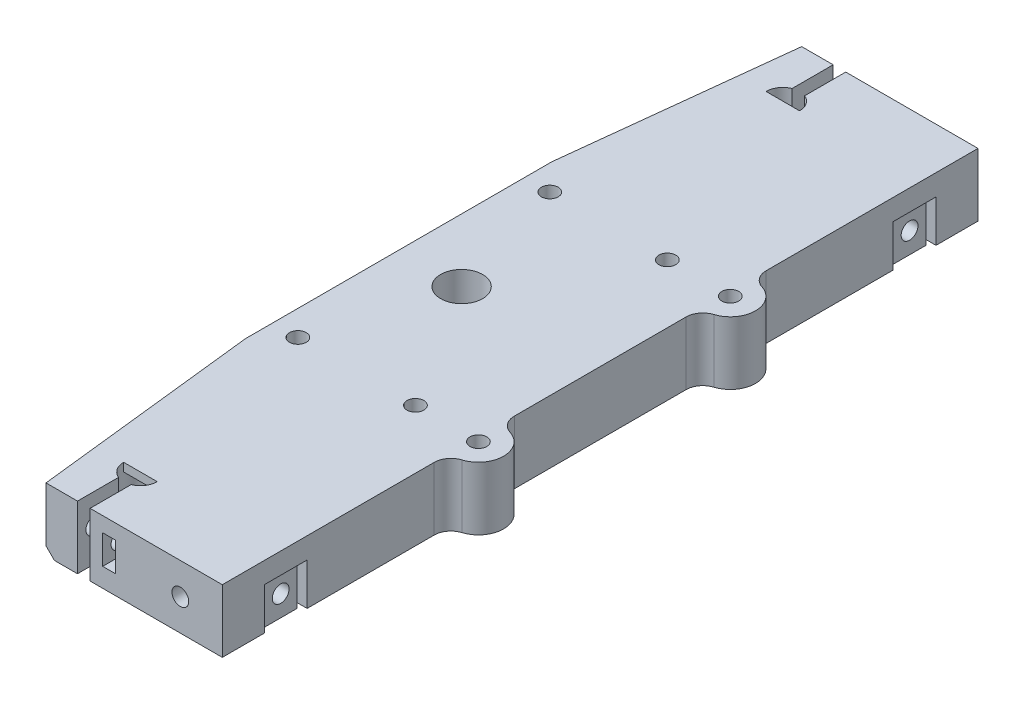
from build123d import *

# Parameters (mm, degrees)
SZKIC1_R                    = 5
SZKIC1_R_2                  = 2
DODANIE_WYCI_GNI_CIE1_DEPTH = 15
DODANIE_WYCI_GNI_CIE3_START = -2
DODANIE_WYCI_GNI_CIE3_DEPTH = 2
DODANIE_WYCI_GNI_CIE4_DEPTH = 15
SZKIC5_R                    = 2
WYTNIJ_WYCI_GNI_CIE1_DEPTH  = 15
ZAOKR_GLENIE1_R             = 4
SFAZOWANIE1_SIZE            = 2
WYTNIJ_WYCI_GNI_CIE3_START  = -7
SZKIC8_R                    = 2
WYTNIJ_WYCI_GNI_CIE3_DEPTH  = 107.031560626
WYTNIJ_WYCI_GNI_CIE4_START  = 8
SZKIC9_R                    = 3.5
WYTNIJ_WYCI_GNI_CIE4_DEPTH  = 4
WYTNIJ_WYCI_GNI_CIE5_START  = -6
SZKIC10_R                   = 2
WYTNIJ_WYCI_GNI_CIE5_DEPTH  = 3
SZKIC11_R                   = 2
WYTNIJ_WYCI_GNI_CIE6_DEPTH  = 7
SZKIC12_W                   = 10.2
SZKIC12_H                   = 10.2
SZKIC12_W_2                 = 7.8
SZKIC12_H_2                 = 7.8
WYTNIJ_WYCI_GNI_CIE7_DEPTH  = 10
SZKIC13_R                   = 2
WYTNIJ_WYCI_GNI_CIE8_DEPTH  = 8


with BuildPart() as part:
    # Szkic1 → Dodanie-wyciągnięcie1 (new body)
    with BuildSketch(Plane(origin=(0, 0, 0), x_dir=(1, 0, 0), z_dir=(0, 1, 0))):
        with BuildLine():
            Line((-14.5, 90), (-20.5, 36.5))
            Line((-20.5, 36.5), (-20.5, -36.5))
            Line((-20.5, -36.5), (-14.5, -90))
            Line((-14.5, -90), (-7, -90))
            Line((-7, -90), (-7, -80.208099244))
            ThreePointArc((-7, -80.208099244), (-5.5, -72.5), (-4, -80.208099244))
            Line((-4, -80.208099244), (-4, -90))
            Line((-4, -90), (27.5, -90))
            Line((27.5, -90), (27.5, 90))
            Line((27.5, 90), (-3.999999674, 90))
            Line((-3.999999674, 90), (-4, 80.208099244))
            ThreePointArc((-4, 80.208099244), (-5.5, 72.5), (-7, 80.208099244))
            Line((-7, 80.208099244), (-6.999999674, 90))
            Line((-6.999999674, 90), (-14.5, 90))
        make_face()
        with Locations((-5.5, 0)):
            Circle(SZKIC1_R, mode=Mode.SUBTRACT)
        with Locations((-14.5, 30)):
            Circle(SZKIC1_R_2, mode=Mode.SUBTRACT)
        with Locations((13.5, 30)):
            Circle(SZKIC1_R_2, mode=Mode.SUBTRACT)
        with Locations((-14.5, -30)):
            Circle(SZKIC1_R_2, mode=Mode.SUBTRACT)
        with Locations((13.5, -30)):
            Circle(SZKIC1_R_2, mode=Mode.SUBTRACT)
    extrude(amount=DODANIE_WYCI_GNI_CIE1_DEPTH)

    # Szkic3 → Dodanie-wyciągnięcie3 (add)
    with BuildSketch(Plane(origin=(0, 15, 0), x_dir=(1, 0, 0), z_dir=(0, 1, 0)).offset(DODANIE_WYCI_GNI_CIE3_START)):
        with BuildLine():
            Line((-1.5, 76.5), (-9.5, 76.5))
            ThreePointArc((-9.5, 76.5), (-5.5, 72.5), (-1.5, 76.5))
        make_face()
        with BuildLine():
            ThreePointArc((-1.5, -76.5), (-5.5, -72.5), (-9.5, -76.5))
            Line((-9.5, -76.5), (-1.5, -76.5))
        make_face()
    extrude(amount=DODANIE_WYCI_GNI_CIE3_DEPTH)

    # Szkic4 → Dodanie-wyciągnięcie4 (add)
    with BuildSketch(Plane(origin=(0, 15, 0), x_dir=(1, 0, 0), z_dir=(0, 1, 0))):
        with BuildLine():
            ThreePointArc((27.5, -28.267949192), (30.5, -30), (27.5, -31.732050808))
            Line((27.5, -31.732050808), (27.5, -35.916079783))
            ThreePointArc((27.5, -35.916079783), (34.5, -30), (27.5, -24.083920217))
            Line((27.5, -24.083920217), (27.5, -28.267949192))
        make_face()
        with BuildLine():
            Line((27.5, 28.267949192), (27.5, 24.083920217))
            ThreePointArc((27.5, 24.083920217), (34.5, 30), (27.5, 35.916079783))
            Line((27.5, 35.916079783), (27.5, 31.732050808))
            ThreePointArc((27.5, 31.732050808), (30.5, 30), (27.5, 28.267949192))
        make_face()
    extrude(amount=-DODANIE_WYCI_GNI_CIE4_DEPTH)

    # Szkic5 → Wytnij-wyciągnięcie1 (cut)
    with BuildSketch(Plane(origin=(0, 15, 0), x_dir=(1, 0, 0), z_dir=(0, 1, 0))):
        with Locations((28.5, 30)):
            Circle(SZKIC5_R)
        with Locations((28.5, -30)):
            Circle(SZKIC5_R)
    extrude(amount=-WYTNIJ_WYCI_GNI_CIE1_DEPTH, mode=Mode.SUBTRACT)

    # Zaokrąglenie1
    zaokr_glenie1_edges = [part.edges().sort_by_distance(p)[0] for p in [
        (27.5, 7.5, -35.916079783),
        (27.5, 7.5, -24.083920217),
        (27.5, 7.5, 24.083920217),
        (27.5, 7.5, 35.916079783),
    ]]
    fillet(zaokr_glenie1_edges, radius=ZAOKR_GLENIE1_R)

    # Sfazowanie1
    sfazowanie1_edges = [part.edges().sort_by_distance(p)[0] for p in [
        (-17.5, 0, -63.25),
        (-17.5, 0, 63.25),
        (-20.5, 0, 0),
    ]]
    chamfer(sfazowanie1_edges, length=SFAZOWANIE1_SIZE)

    # Szkic8 → Wytnij-wyciągnięcie3 (cut)
    with BuildSketch(Plane.ZY.offset(4).offset(WYTNIJ_WYCI_GNI_CIE3_START)):
        with Locations((86, 8)):
            Circle(SZKIC8_R)
    wytnij_wyci_gni_cie3 = extrude(amount=WYTNIJ_WYCI_GNI_CIE3_DEPTH, mode=Mode.SUBTRACT)

    # Szkic9 → Wytnij-wyciągnięcie4 (cut)
    with BuildSketch(Plane.ZY.offset(4).offset(WYTNIJ_WYCI_GNI_CIE4_START)):
        with Locations((86, 8)):
            Circle(SZKIC9_R)
    wytnij_wyci_gni_cie4 = extrude(amount=WYTNIJ_WYCI_GNI_CIE4_DEPTH, mode=Mode.SUBTRACT)

    # Szkic10 → Wytnij-wyciągnięcie5 (cut)
    with BuildSketch(Plane.ZY.offset(4).offset(WYTNIJ_WYCI_GNI_CIE5_START)):
        Polygon((83, 6.267949192), (86, 4.535898385), (90, 4.535898385), (90, 11.464101615), (86, 11.464101615), (83, 9.732050808), align=None)
        with Locations((86, 8)):
            Circle(SZKIC10_R, mode=Mode.SUBTRACT)
    wytnij_wyci_gni_cie5 = extrude(amount=WYTNIJ_WYCI_GNI_CIE5_DEPTH, mode=Mode.SUBTRACT)

    # Lustro2: Wytnij-wyciągnięcie3, Wytnij-wyciągnięcie4, Wytnij-wyciągnięcie5 across plane
    add(wytnij_wyci_gni_cie3.mirror(Plane.XY), mode=Mode.SUBTRACT)
    add(wytnij_wyci_gni_cie4.mirror(Plane.XY), mode=Mode.SUBTRACT)
    add(wytnij_wyci_gni_cie5.mirror(Plane.XY), mode=Mode.SUBTRACT)

    # Szkic11 → Wytnij-wyciągnięcie6 (cut)
    with BuildSketch(Plane.XY.offset(90)):
        with Locations((17.5, 7.5)):
            Circle(SZKIC11_R)
    wytnij_wyci_gni_cie6 = extrude(amount=-WYTNIJ_WYCI_GNI_CIE6_DEPTH, mode=Mode.SUBTRACT)

    # Lustro3: Wytnij-wyciągnięcie6 across plane
    add(wytnij_wyci_gni_cie6.mirror(Plane.XY), mode=Mode.SUBTRACT)

    # Szkic12 → Wytnij-wyciągnięcie7 (cut)
    # profile 1 of 2: a face of its own
    with BuildSketch(Plane.XZ):
        with Locations((22.4, 74.9)):
            Rectangle(SZKIC12_W, SZKIC12_H)
        with Locations((22.4, 74.9)):
            Rectangle(SZKIC12_W_2, SZKIC12_H_2, mode=Mode.SUBTRACT)
    # profile 2 of 2: a face of its own
    with BuildSketch(Plane.XZ):
        with Locations((22.4, -74.9)):
            Rectangle(SZKIC12_W, SZKIC12_H)
        with Locations((22.4, -74.9)):
            Rectangle(SZKIC12_W_2, SZKIC12_H_2, mode=Mode.SUBTRACT)
    extrude(amount=-WYTNIJ_WYCI_GNI_CIE7_DEPTH, mode=Mode.SUBTRACT)

    # Szkic13 → Wytnij-wyciągnięcie8 (cut)
    with BuildSketch(Plane(origin=(26.3, 0, 0), x_dir=(0, 0, -1), z_dir=(1, 0, 0))):
        with Locations((74.9, 5)):
            Circle(SZKIC13_R)
        with Locations((-74.9, 5)):
            Circle(SZKIC13_R)
    extrude(amount=-WYTNIJ_WYCI_GNI_CIE8_DEPTH, mode=Mode.SUBTRACT)


solid = part.part
